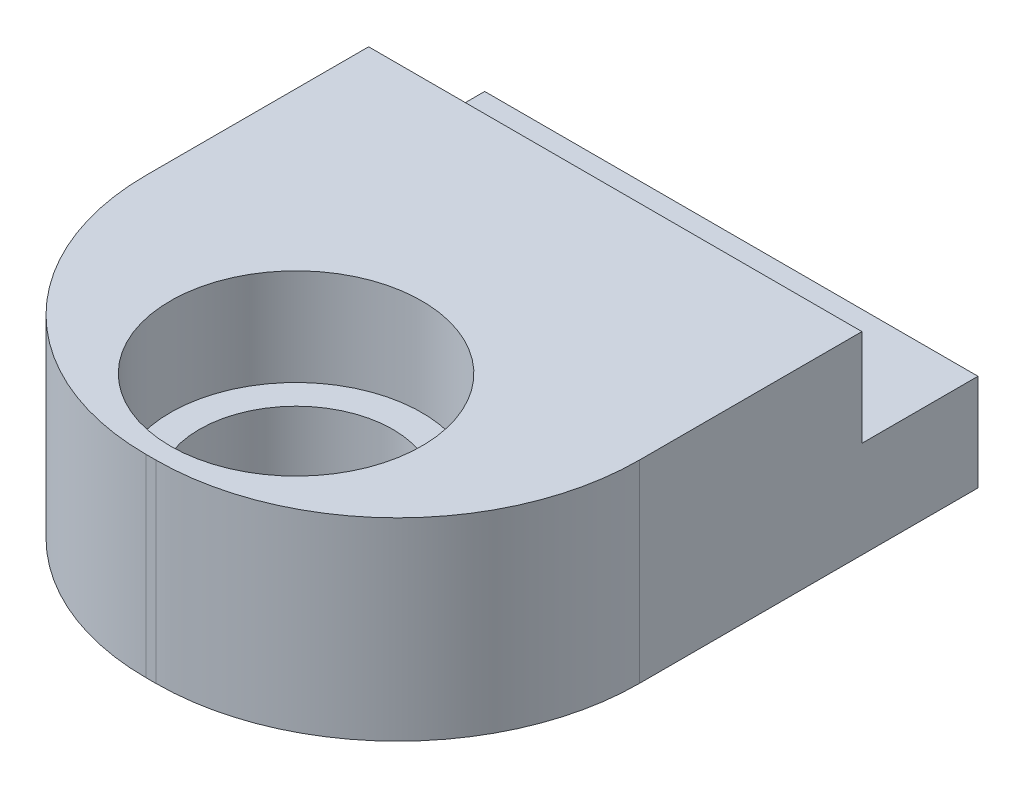
from build123d import *

# Parameters (mm, degrees)
SZKIC1_W                    = 51
SZKIC1_H                    = 60
SZKIC1_R                    = 3.25
SZKIC1_R_2                  = 10
DODANIE_WYCI_GNI_CIE1_DEPTH = 10
DODANIE_WYCI_GNI_CIE2_START = 10
SZKIC2_W                    = 51
SZKIC2_H                    = 48
SZKIC2_R                    = 13
DODANIE_WYCI_GNI_CIE2_DEPTH = 10
ZAOKR_GLENIE1_R             = 25


with BuildPart() as part:
    # Szkic1 → Dodanie-wyciągnięcie1 (new body)
    with BuildSketch(Plane(origin=(0, 0, 0), x_dir=(1, 0, 0), z_dir=(0, 1, 0))):
        Rectangle(SZKIC1_W, SZKIC1_H)
        with Locations(Location((0, 24, 0), (0, 0, 270))):
            Circle(SZKIC1_R, mode=Mode.SUBTRACT)
        with Locations(Location((0, -15, 0), (0, 0, 270))):
            Circle(SZKIC1_R_2, mode=Mode.SUBTRACT)
    extrude(amount=DODANIE_WYCI_GNI_CIE1_DEPTH)

    # Szkic2 → Dodanie-wyciągnięcie2 (add)
    with BuildSketch(Plane(origin=(0, 0, 0), x_dir=(1, 0, 0), z_dir=(0, 1, 0)).offset(DODANIE_WYCI_GNI_CIE2_START)):
        with Locations((0, -6)):
            Rectangle(SZKIC2_W, SZKIC2_H)
        with Locations(Location((0, -15, 0), (0, 0, 270))):
            Circle(SZKIC2_R, mode=Mode.SUBTRACT)
    extrude(amount=DODANIE_WYCI_GNI_CIE2_DEPTH)

    # Zaokrąglenie1
    zaokr_glenie1_edges = [part.edges().sort_by_distance(p)[0] for p in [
        (25.5, 10, 30),
        (-25.5, 10, 30),
    ]]
    fillet(zaokr_glenie1_edges, radius=ZAOKR_GLENIE1_R)


solid = part.part
